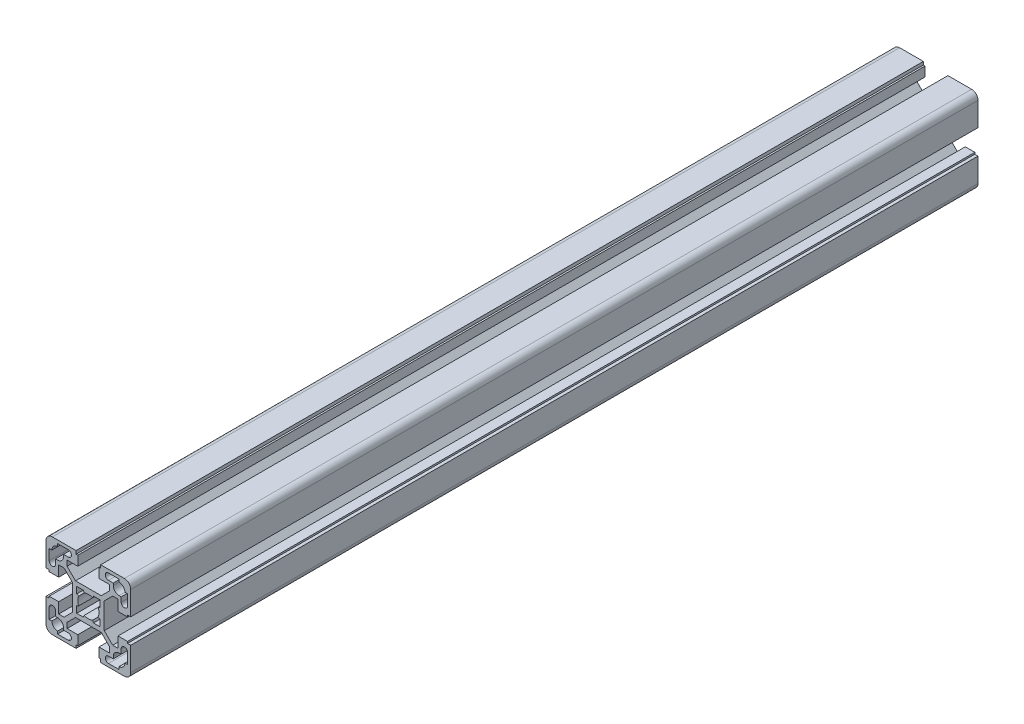
from build123d import *

# Parameters (mm, degrees)
EXTRUDE1_DEPTH = 400


with BuildPart() as part:
    # Sketch1 → Extrude1 (new body)
    with BuildSketch(Plane.XY):
        with BuildLine():
            Line((5.8, -20), (17, -20))
            ThreePointArc((17, -20), (19.121320344, -19.121320344), (20, -17))
            Line((20, -17), (20, -5.8))
            Line((20, -5.8), (18.5, -5.8))
            Line((18.5, -5.8), (18.5, -5))
            Line((18.5, -5), (14, -5))
            Line((14, -5), (14, -10.05))
            Line((14, -10.05), (11.464213562, -10.05))
            Line((11.464213562, -10.05), (7.5, -6.085786438))
            Line((7.5, -6.085786438), (7.5, 6.085786438))
            Line((7.5, 6.085786438), (11.464213562, 10.05))
            Line((11.464213562, 10.05), (14, 10.05))
            Line((14, 10.05), (14, 5))
            Line((14, 5), (18.5, 5))
            Line((18.5, 5), (18.5, 5.8))
            Line((18.5, 5.8), (20, 5.8))
            Line((20, 5.8), (20, 17))
            ThreePointArc((20, 17), (19.121320344, 19.121320344), (17, 20))
            Line((17, 20), (5.8, 20))
            Line((5.8, 20), (5.8, 18.5))
            Line((5.8, 18.5), (5, 18.5))
            Line((5, 18.5), (5, 14))
            Line((5, 14), (10.05, 14))
            Line((10.05, 14), (10.05, 11.464213562))
            Line((10.05, 11.464213562), (6.085786438, 7.5))
            Line((6.085786438, 7.5), (-6.085786438, 7.5))
            Line((-6.085786438, 7.5), (-10.05, 11.464213562))
            Line((-10.05, 11.464213562), (-10.05, 14))
            Line((-10.05, 14), (-5, 14))
            Line((-5, 14), (-5, 18.5))
            Line((-5, 18.5), (-5.8, 18.5))
            Line((-5.8, 18.5), (-5.8, 20))
            Line((-5.8, 20), (-17, 20))
            ThreePointArc((-17, 20), (-19.121320344, 19.121320344), (-20, 17))
            Line((-20, 17), (-20, 5.8))
            Line((-20, 5.8), (-18.5, 5.8))
            Line((-18.5, 5.8), (-18.5, 5))
            Line((-18.5, 5), (-14, 5))
            Line((-14, 5), (-14, 10.05))
            Line((-14, 10.05), (-11.464213562, 10.05))
            Line((-11.464213562, 10.05), (-7.5, 6.085786438))
            Line((-7.5, 6.085786438), (-7.5, -6.085786438))
            Line((-7.5, -6.085786438), (-11.464213562, -10.05))
            Line((-11.464213562, -10.05), (-14, -10.05))
            Line((-14, -10.05), (-14, -5))
            Line((-14, -5), (-18.5, -5))
            Line((-18.5, -5), (-18.5, -5.8))
            Line((-18.5, -5.8), (-20, -5.8))
            Line((-20, -5.8), (-20, -17))
            ThreePointArc((-20, -17), (-19.121320344, -19.121320344), (-17, -20))
            Line((-17, -20), (-5.8, -20))
            Line((-5.8, -20), (-5.8, -18.5))
            Line((-5.8, -18.5), (-5, -18.5))
            Line((-5, -18.5), (-5, -14))
            Line((-5, -14), (-10.05, -14))
            Line((-10.05, -14), (-10.05, -11.464213562))
            Line((-10.05, -11.464213562), (-6.085786438, -7.5))
            Line((-6.085786438, -7.5), (6.085786438, -7.5))
            Line((6.085786438, -7.5), (10.05, -11.464213562))
            Line((10.05, -11.464213562), (10.05, -14))
            Line((10.05, -14), (5, -14))
            Line((5, -14), (5, -18.5))
            Line((5, -18.5), (5.8, -18.5))
            Line((5.8, -18.5), (5.8, -20))
        make_face()
        with BuildLine():
            Line((14.5, -18.5), (9.5, -18.5))
            ThreePointArc((9.5, -18.5), (8, -17), (9.5, -15.5))
            Line((9.5, -15.5), (11.75, -15.5))
            Line((11.75, -15.5), (11.75, -14.5))
            ThreePointArc((11.75, -14.5), (12.555456352, -12.555456352), (14.5, -11.75))
            Line((14.5, -11.75), (15.5, -11.75))
            Line((15.5, -11.75), (15.5, -9.5))
            ThreePointArc((15.5, -9.5), (17, -8), (18.5, -9.5))
            Line((18.5, -9.5), (18.5, -14.5))
            Line((18.5, -14.5), (17.25, -14.5))
            ThreePointArc((17.25, -14.5), (16.444543648, -16.444543648), (14.5, -17.25))
            Line((14.5, -17.25), (14.5, -18.5))
        make_face(mode=Mode.SUBTRACT)
        with BuildLine():
            Line((18.5, 14.5), (17.25, 14.5))
            ThreePointArc((17.25, 14.5), (16.444543648, 16.444543648), (14.5, 17.25))
            Line((14.5, 17.25), (14.5, 18.5))
            Line((14.5, 18.5), (9.5, 18.5))
            ThreePointArc((9.5, 18.5), (8, 17), (9.5, 15.5))
            Line((9.5, 15.5), (11.75, 15.5))
            Line((11.75, 15.5), (11.75, 14.5))
            ThreePointArc((11.75, 14.5), (12.555456352, 12.555456352), (14.5, 11.75))
            Line((14.5, 11.75), (15.5, 11.75))
            Line((15.5, 11.75), (15.5, 9.5))
            ThreePointArc((15.5, 9.5), (17, 8), (18.5, 9.5))
            Line((18.5, 9.5), (18.5, 14.5))
        make_face(mode=Mode.SUBTRACT)
        with BuildLine():
            Line((5.5, 5.5), (2.397915762, 5.5))
            Line((2.397915762, 5.5), (1.998263135, 4.583333333))
            ThreePointArc((1.998263135, 4.583333333), (0, 5), (-1.998263135, 4.583333333))
            Line((-1.998263135, 4.583333333), (-2.397915762, 5.5))
            Line((-2.397915762, 5.5), (-5.5, 5.5))
            Line((-5.5, 5.5), (-5.5, 2.397915762))
            Line((-5.5, 2.397915762), (-4.583333333, 1.998263135))
            ThreePointArc((-4.583333333, 1.998263135), (-5, 0), (-4.583333333, -1.998263135))
            Line((-4.583333333, -1.998263135), (-5.5, -2.397915762))
            Line((-5.5, -2.397915762), (-5.5, -5.5))
            Line((-5.5, -5.5), (-2.397915762, -5.5))
            Line((-2.397915762, -5.5), (-1.998263135, -4.583333333))
            ThreePointArc((-1.998263135, -4.583333333), (0, -5), (1.998263135, -4.583333333))
            Line((1.998263135, -4.583333333), (2.397915762, -5.5))
            Line((2.397915762, -5.5), (5.5, -5.5))
            Line((5.5, -5.5), (5.5, -2.397915762))
            Line((5.5, -2.397915762), (4.583333333, -1.998263135))
            ThreePointArc((4.583333333, -1.998263135), (5, 0), (4.583333333, 1.998263135))
            Line((4.583333333, 1.998263135), (5.5, 2.397915762))
            Line((5.5, 2.397915762), (5.5, 5.5))
        make_face(mode=Mode.SUBTRACT)
        with BuildLine():
            Line((-18.5, -14.5), (-17.25, -14.5))
            ThreePointArc((-17.25, -14.5), (-16.444543648, -16.444543648), (-14.5, -17.25))
            Line((-14.5, -17.25), (-14.5, -18.5))
            Line((-14.5, -18.5), (-9.5, -18.5))
            ThreePointArc((-9.5, -18.5), (-8, -17), (-9.5, -15.5))
            Line((-9.5, -15.5), (-11.75, -15.5))
            Line((-11.75, -15.5), (-11.75, -14.5))
            ThreePointArc((-11.75, -14.5), (-12.555456352, -12.555456352), (-14.5, -11.75))
            Line((-14.5, -11.75), (-15.5, -11.75))
            Line((-15.5, -11.75), (-15.5, -9.5))
            ThreePointArc((-15.5, -9.5), (-17, -8), (-18.5, -9.5))
            Line((-18.5, -9.5), (-18.5, -14.5))
        make_face(mode=Mode.SUBTRACT)
        with BuildLine():
            Line((-14.5, 18.5), (-9.5, 18.5))
            ThreePointArc((-9.5, 18.5), (-8, 17), (-9.5, 15.5))
            Line((-9.5, 15.5), (-11.75, 15.5))
            Line((-11.75, 15.5), (-11.75, 14.5))
            ThreePointArc((-11.75, 14.5), (-12.555456352, 12.555456352), (-14.5, 11.75))
            Line((-14.5, 11.75), (-15.5, 11.75))
            Line((-15.5, 11.75), (-15.5, 9.5))
            ThreePointArc((-15.5, 9.5), (-17, 8), (-18.5, 9.5))
            Line((-18.5, 9.5), (-18.5, 14.5))
            Line((-18.5, 14.5), (-17.25, 14.5))
            ThreePointArc((-17.25, 14.5), (-16.444543648, 16.444543648), (-14.5, 17.25))
            Line((-14.5, 17.25), (-14.5, 18.5))
        make_face(mode=Mode.SUBTRACT)
    extrude(amount=EXTRUDE1_DEPTH)


solid = part.part
